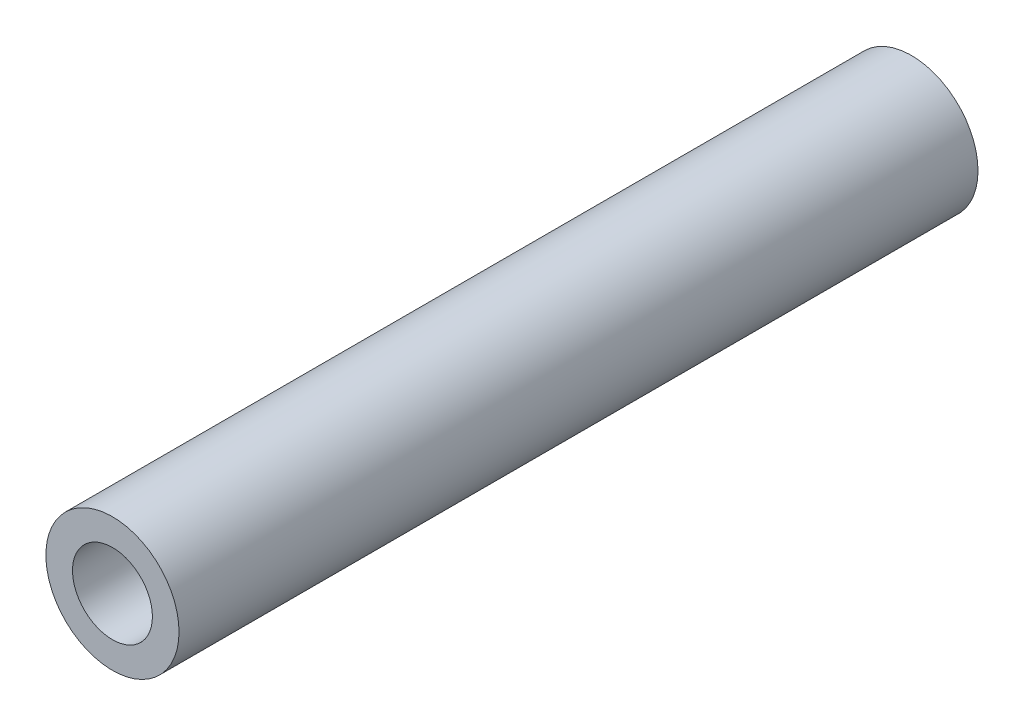
from build123d import *

# Parameters (mm, degrees)
SKETCH1_R           = 2.5
BOSS_EXTRUDE1_DEPTH = 30
SKETCH2_R           = 1.5
CUT_EXTRUDE1_DEPTH  = 16


with BuildPart() as part:
    # Sketch1 → Boss-Extrude1 (new body)
    with BuildSketch(Plane.XY):
        Circle(SKETCH1_R)
    extrude(amount=BOSS_EXTRUDE1_DEPTH)

    # Sketch2 → Cut-Extrude1 (cut)
    with BuildSketch(Plane.XY.offset(30)):
        Circle(SKETCH2_R)
    extrude(amount=-CUT_EXTRUDE1_DEPTH, mode=Mode.SUBTRACT)


solid = part.part
